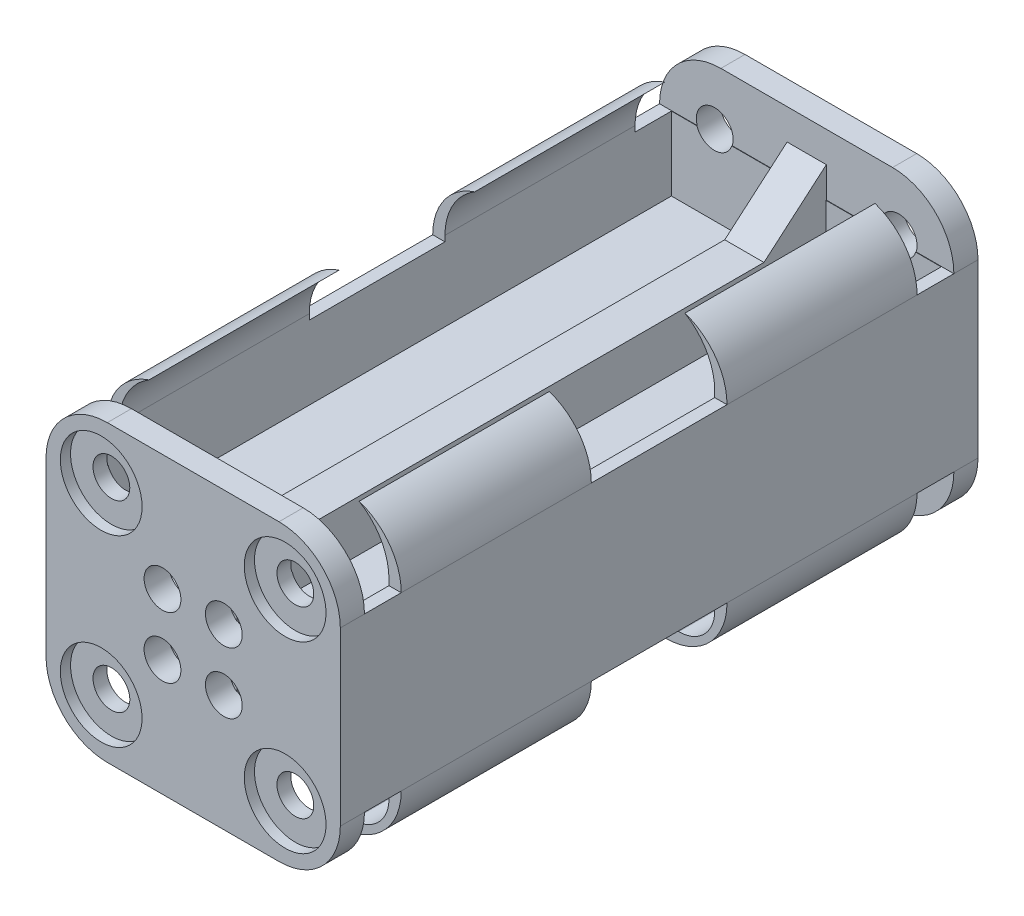
from build123d import *

# Parameters (mm, degrees)
BOSS_EXTRU_1_DEPTH            = 62.4
ENL_V_MAT_EXTRU_1_DEPTH       = 27.6
ESQUISSE4_W                   = 3.6
ESQUISSE4_H                   = 10.193897514
ENL_V_MAT_EXTRU_2_DEPTH       = 62.4
ENL_V_MAT_EXTRU_5_REACH       = 74.618
ENL_V_START                   = -2.4
ESQUISSE7_R                   = 1.8
ENL_V_MAT_EXTRU_8_DEPTH       = 40
ESQUISSE8_R                   = 1.8
ENL_V_MAT_EXTRU_9_DEPTH       = 70
ENL_V_MAT_EXTRU_10_DEPTH      = 70
ENL_V_MAT_EXTRU_10_DEPTH_BACK = 70
ESQUISSE9_W                   = 3.6
ESQUISSE9_H                   = 8.374446498
ESQUISSE9_W_2                 = 13.276842972
ESQUISSE9_H_2                 = 11.709125621
ESQUISSE9_H_3                 = 11.001769443
ESQUISSE10_W                  = 28.8
ESQUISSE10_H                  = 2.4
BOSS_EXTRU_2_DEPTH            = 60
ESQUISSE12_W                  = 16.8
ESQUISSE12_H                  = 18.6
ENL_V_MAT_EXTRU_11_DEPTH      = 4
BOSS_EXTRU_3_DEPTH            = 1.92
BOSS_EXTRU_3_DEPTH_BACK       = 1.92
ESQUISSE14_R                  = 4
ENL_V_MAT_EXTRU_12_DEPTH      = 1


with BuildPart() as part:
    # Esquisse1 → Boss.-Extru.1 (new body)
    with BuildSketch(Plane.XY):
        with BuildLine():
            Line((8.4, 0), (-8.4, 0))
            ThreePointArc((-8.4, 0), (-12.642640687, -1.757359313), (-14.4, -6))
            Line((-14.4, -6), (-14.4, -22.8))
            ThreePointArc((-14.4, -22.8), (-12.642640687, -27.042640687), (-8.4, -28.8))
            Line((-8.4, -28.8), (8.4, -28.8))
            ThreePointArc((8.4, -28.8), (12.642640687, -27.042640687), (14.4, -22.8))
            Line((14.4, -22.8), (14.4, -6))
            ThreePointArc((14.4, -6), (12.642640687, -1.757359313), (8.4, 0))
        make_face()
    extrude(amount=-BOSS_EXTRU_1_DEPTH)

    # Esquisse2 → Enlèv. mat.-Extru.1 (cut)
    with BuildSketch(Plane(origin=(0, 0, 0), x_dir=(1, 0, 0), z_dir=(0, 1, 0))):
        Polygon((0, 2.4), (-8.4, 2.4), (-8.4, 60), (0, 60), (8.4, 60), (8.4, 2.4), align=None)
    extrude(amount=-ENL_V_MAT_EXTRU_1_DEPTH, mode=Mode.SUBTRACT)

    # Esquisse4 → Enlèv. mat.-Extru.2 (cut)
    with BuildSketch(Plane(origin=(14.4, 0, 0), x_dir=(0, 0, -1), z_dir=(1, 0, 0))):
        with Locations((4.161578514, -0.903051243)):
            Rectangle(ESQUISSE4_W, ESQUISSE4_H)
        Polygon((24.561578514, 4.193897514), (24.561578514, -6), (37.838421486, -6), (37.838421486, 4.193897514), (31.238421486, 4.193897514), (31.161578514, 4.193897514), align=None)
        with Locations((58.238421486, -0.903051243)):
            Rectangle(ESQUISSE4_W, ESQUISSE4_H)
    extrude(amount=-ENL_V_MAT_EXTRU_2_DEPTH, mode=Mode.SUBTRACT)

    # Enlèv. mat.-Extru.5: up to this face of the body (flat: up to its plane)
    enl_v_mat_extru_5_end = Plane(part.part.faces().sort_by_distance((0, -16.8, -60))[0])
    # Esquisse5 → Enlèv. mat.-Extru.5 (cut, up to the picked face)
    with BuildSketch(Plane.XY.offset(ENL_V_START), mode=Mode.PRIVATE) as enl_v_mat_extru_5_sk1:
        with BuildLine():
            Line((-7.2, 0.549733926), (7.2, 0.549733926))
            ThreePointArc((7.2, 0.549733926), (11.442640687, -1.207625387), (13.2, -5.450266074))
            Line((13.2, -5.450266074), (13.2, -13.850266074))
            Line((13.2, -13.850266074), (13.2, -14.949733926))
            Line((13.2, -14.949733926), (13.2, -23.349733926))
            Line((13.2, -23.349733926), (13.2, -24.06586829))
            ThreePointArc((13.2, -24.06586829), (12.164876788, -26.564876788), (9.66586829, -27.6))
            Line((9.66586829, -27.6), (0, -27.6))
            Line((0, -27.6), (-9.2, -27.6))
            ThreePointArc((-9.2, -27.6), (-12.028427125, -26.428427125), (-13.2, -23.6))
            Line((-13.2, -23.6), (-13.2, -23.349733926))
            Line((-13.2, -23.349733926), (-13.2, -14.949733926))
            Line((-13.2, -14.949733926), (-13.2, -13.850266074))
            Line((-13.2, -13.850266074), (-13.2, -5.450266074))
            ThreePointArc((-13.2, -5.450266074), (-11.442640687, -1.207625387), (-7.2, 0.549733926))
        make_face()
    enl_v_mat_extru_5_tool1 = split(extrude(enl_v_mat_extru_5_sk1.sketch, amount=-ENL_V_MAT_EXTRU_5_REACH, mode=Mode.PRIVATE), bisect_by=enl_v_mat_extru_5_end, keep=Keep.BOTH, mode=Mode.PRIVATE)
    add(enl_v_mat_extru_5_tool1.solids().sort_by(Axis((0.01246, -13.685747, -2.4), (0, 0, -1)))[0], mode=Mode.SUBTRACT)

    # Esquisse7 → Enlèv. mat.-Extru.8 (cut)
    with BuildSketch(Plane.XY):
        with Locations((3, -11.4)):
            Circle(ESQUISSE7_R)
        with Locations((-3, -11.4)):
            Circle(ESQUISSE7_R)
        with Locations((3, -17.4)):
            Circle(ESQUISSE7_R)
        with Locations((-3, -17.4)):
            Circle(ESQUISSE7_R)
    extrude(amount=-ENL_V_MAT_EXTRU_8_DEPTH, mode=Mode.SUBTRACT)

    # Esquisse8 → Enlèv. mat.-Extru.9 (cut)
    with BuildSketch(Plane.XY):
        with Locations((-9, -5.430075377)):
            Circle(ESQUISSE8_R)
        with Locations(Location((9, -5.430075377, 0), (0, 0, 341.541071197))):
            Circle(ESQUISSE8_R)
        with Locations((9, -23.369924623)):
            Circle(ESQUISSE8_R)
        with Locations((-9, -23.369924623)):
            Circle(ESQUISSE8_R)
    extrude(amount=-ENL_V_MAT_EXTRU_9_DEPTH, mode=Mode.SUBTRACT)

    # Esquisse9 → Enlèv. mat.-Extru.10 (cut, two sides: drawn at the far end of the back side and taken through both)
    with BuildSketch(Plane(origin=(0, 0, 0), x_dir=(0, 0, -1), z_dir=(1, 0, 0)).offset(-ENL_V_MAT_EXTRU_10_DEPTH_BACK)):
        with Locations((4.161578514, -26.987223249)):
            Rectangle(ESQUISSE9_W, ESQUISSE9_H)
        with Locations((31.2, -28.654562811)):
            Rectangle(ESQUISSE9_W_2, ESQUISSE9_H_2)
        with Locations((58.238421486, -28.300884722)):
            Rectangle(ESQUISSE9_W, ESQUISSE9_H_3)
    extrude(amount=ENL_V_MAT_EXTRU_10_DEPTH + ENL_V_MAT_EXTRU_10_DEPTH_BACK, mode=Mode.SUBTRACT)

    # Esquisse10 → Boss.-Extru.2 (add)
    with BuildSketch(Plane.XY):
        with Locations((0, -14.4)):
            Rectangle(ESQUISSE10_W, ESQUISSE10_H)
    extrude(amount=-BOSS_EXTRU_2_DEPTH)

    # Esquisse12 → Enlèv. mat.-Extru.11 (cut)
    with BuildSketch(Plane.XZ.offset(28.8)):
        with Locations((0, -47.138421486)):
            Rectangle(ESQUISSE12_W, ESQUISSE12_H)
        with Locations((0, -15.261578514)):
            Rectangle(ESQUISSE12_W, ESQUISSE12_H)
    extrude(amount=-ENL_V_MAT_EXTRU_11_DEPTH, mode=Mode.SUBTRACT)

    # Esquisse13 → Boss.-Extru.3 (add, two sides: drawn at the far end of the back side and taken through both)
    with BuildSketch(Plane(origin=(0, 0, 0), x_dir=(0, 0, -1), z_dir=(1, 0, 0)).offset(-BOSS_EXTRU_3_DEPTH_BACK)):
        Polygon((60.038421486, -3), (53.936448566, -8.235896166), (8.463551434, -8.235896166), (2.361578514, -3), (2.361578514, -25.8), (8.463551434, -20.564103834), (53.936448566, -20.564103834), (60.038421486, -25.8), align=None)
    extrude(amount=BOSS_EXTRU_3_DEPTH + BOSS_EXTRU_3_DEPTH_BACK)

    # Esquisse14 → Enlèv. mat.-Extru.12 (cut)
    with BuildSketch(Plane.XY):
        with Locations((-9, -5.430075377)):
            Circle(ESQUISSE14_R)
        with Locations(Location((9, -5.430075377, 0), (0, 0, 180))):
            Circle(ESQUISSE14_R)
        with Locations((9, -23.369924623)):
            Circle(ESQUISSE14_R)
        with Locations(Location((-9, -23.369924623, 0), (0, 0, 180))):
            Circle(ESQUISSE14_R)
    extrude(amount=-ENL_V_MAT_EXTRU_12_DEPTH, mode=Mode.SUBTRACT)


solid = part.part
